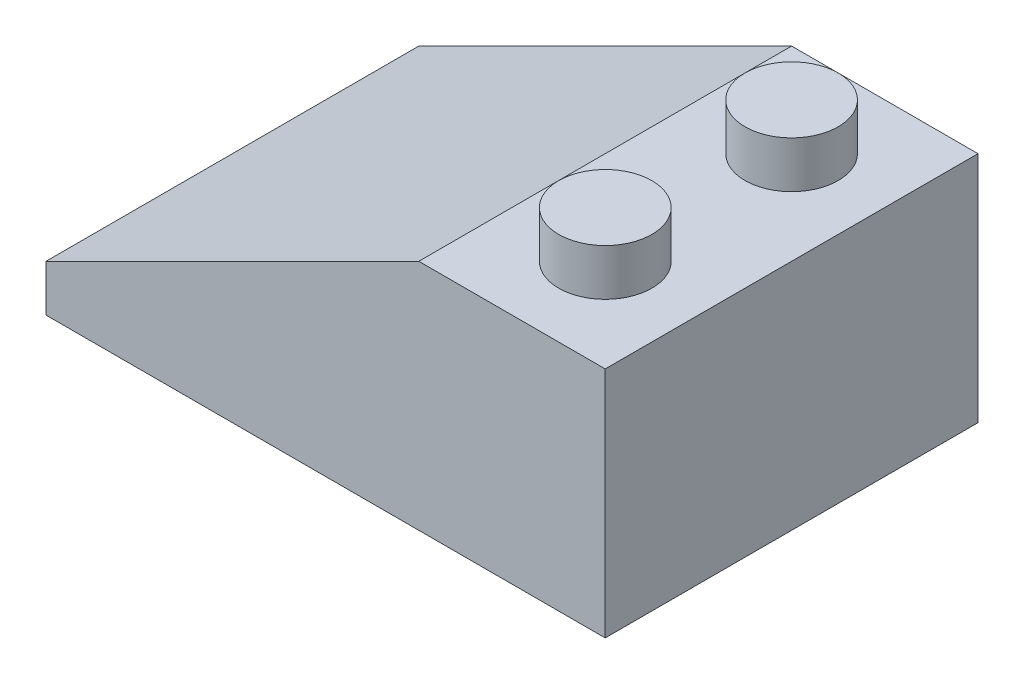
from build123d import *

# Parameters (mm, degrees)
BOSS_EXTRUDE1_DEPTH      = 8
BOSS_EXTRUDE1_DEPTH_BACK = 8
SKETCH3_R                = 2
BOSS_EXTRUDE2_DEPTH      = 2
SHELL1_T                 = -1
BOSS_EXTRUDE3_REACH      = 30
SKETCH4_R                = 2.7
SKETCH4_R_2              = 1.7


with BuildPart() as part:
    # Sketch2 → Boss-Extrude1 (new, two sides: drawn at the far end of the back side and taken through both)
    with BuildSketch(Plane.XY.offset(-BOSS_EXTRUDE1_DEPTH_BACK)):
        Polygon((0, 0), (-24, 0), (-24, 2), (-8, 10), (0, 10), align=None)
    extrude(amount=BOSS_EXTRUDE1_DEPTH + BOSS_EXTRUDE1_DEPTH_BACK)

    # Sketch3 → Boss-Extrude2 (add)
    with BuildSketch(Plane(origin=(0, 10, 0), x_dir=(1, 0, 0), z_dir=(0, 1, 0))):
        with Locations((-3.996369041, -4)):
            Circle(SKETCH3_R)
        with Locations((-4, 4)):
            Circle(SKETCH3_R)
    extrude(amount=BOSS_EXTRUDE2_DEPTH)

    # Shell1
    shell1_openings = [part.faces().sort_by_distance(p)[0] for p in [
        (-12, 0, 0),
    ]]
    offset(amount=SHELL1_T, openings=shell1_openings, kind=Kind.INTERSECTION)

    # Sketch4 → Boss-Extrude3 (add, up to next)
    with BuildSketch(Plane.XZ, mode=Mode.PRIVATE) as boss_extrude3_sk1:
        with Locations((-8, 0)):
            Circle(SKETCH4_R)
        with Locations((-8, 0)):
            Circle(SKETCH4_R_2, mode=Mode.SUBTRACT)
    boss_extrude3_tool1 = extrude(boss_extrude3_sk1.sketch, amount=-BOSS_EXTRUDE3_REACH, mode=Mode.PRIVATE) - part.part
    # Sketch4 → Boss-Extrude3 (add, up to next)
    with BuildSketch(Plane.XZ, mode=Mode.PRIVATE) as boss_extrude3_sk2:
        with Locations((-16, 0)):
            Circle(SKETCH4_R)
        with Locations((-16, 0)):
            Circle(SKETCH4_R_2, mode=Mode.SUBTRACT)
    boss_extrude3_tool2 = extrude(boss_extrude3_sk2.sketch, amount=-BOSS_EXTRUDE3_REACH, mode=Mode.PRIVATE) - part.part
    add(boss_extrude3_tool1.solids().sort_by_distance((-10.623632, 0, 0))[0])
    add(boss_extrude3_tool2.solids().sort_by_distance((-18.623632, 0, 0))[0])


solid = part.part
